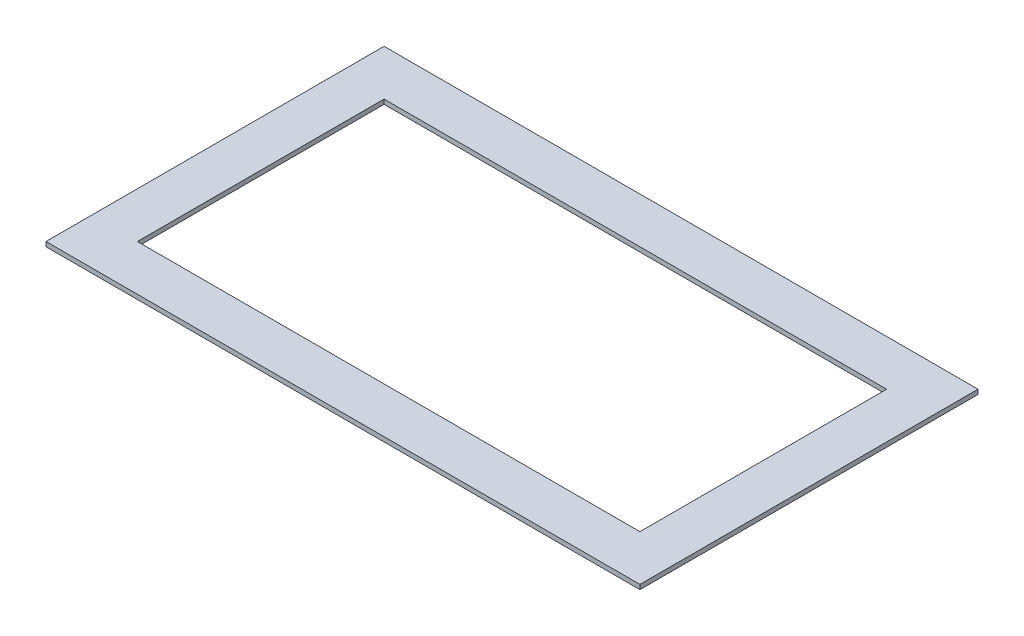
from build123d import *

# Parameters (mm, degrees)
SKETCH_1_W      = 65
SKETCH_1_H      = 37
SKETCH_1_W_2    = 55
SKETCH_1_H_2    = 27
EXTRUDE_1_DEPTH = 0.5


with BuildPart() as part:
    # 草图1 → 凸台-拉伸1 (new body)
    with BuildSketch(Plane(origin=(0, 0, 0), x_dir=(1, 0, 0), z_dir=(0, 1, 0))):
        Rectangle(SKETCH_1_W, SKETCH_1_H)
        Rectangle(SKETCH_1_W_2, SKETCH_1_H_2, mode=Mode.SUBTRACT)
    extrude(amount=EXTRUDE_1_DEPTH)


solid = part.part
